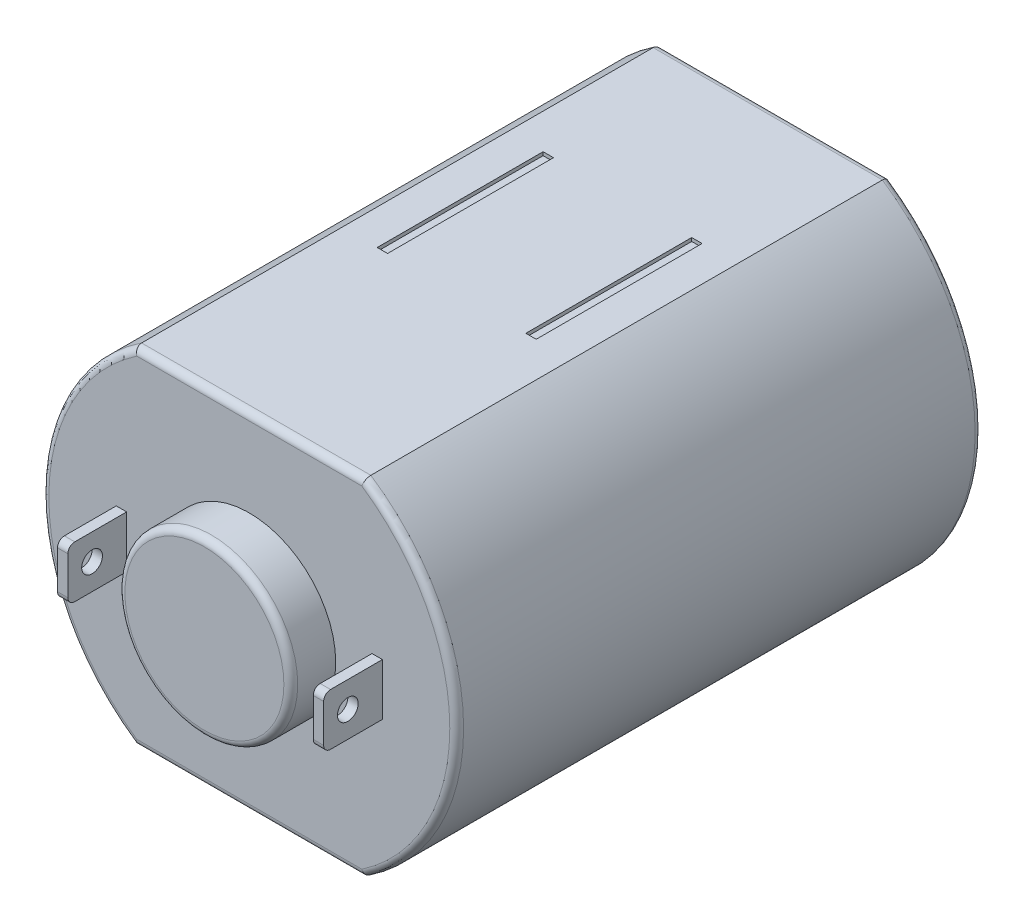
from build123d import *

# Parameters (mm, degrees)
AUFSATZ_LINEAR_AUSTRAGEN1_DEPTH = 15.2
SKIZZE2_R                       = 2.5
AUFSATZ_LINEAR_AUSTRAGEN2_DEPTH = 1.3
SKIZZE3_R                       = 0.5
AUFSATZ_LINEAR_AUSTRAGEN3_DEPTH = 2
VERRUNDUNG1_R                   = 0.2
SKIZZE4_W                       = 0.3
SKIZZE4_H                       = 4.8
SCHNITT_LINEAR_AUSTRAGEN1_DEPTH = 0.1
SKIZZE5_W                       = 0.3
SKIZZE5_H                       = 1.5
AUFSATZ_LINEAR_AUSTRAGEN4_DEPTH = 1.7
SCHNITT_LINEAR_AUSTRAGEN2_REACH = 22.19
SKIZZE6_R                       = 0.3
VERRUNDUNG2_R                   = 0.2


with BuildPart() as part:
    # Skizze1 → Aufsatz-Linear austragen1 (new body)
    with BuildSketch(Plane.XY):
        with BuildLine():
            Line((-3.31662479, 5), (3.31662479, 5))
            ThreePointArc((3.31662479, 5), (6, 0), (3.31662479, -5))
            Line((3.31662479, -5), (-3.31662479, -5))
            ThreePointArc((-3.31662479, -5), (-6, 0), (-3.31662479, 5))
        make_face()
    extrude(amount=AUFSATZ_LINEAR_AUSTRAGEN1_DEPTH)

    # Skizze2 → Aufsatz-Linear austragen2 (add)
    with BuildSketch(Plane.XY.offset(15.2)):
        Circle(SKIZZE2_R)
    extrude(amount=AUFSATZ_LINEAR_AUSTRAGEN2_DEPTH)

    # Skizze3 → Aufsatz-Linear austragen3 (add)
    with BuildSketch(Plane(origin=(0, 0, 0), x_dir=(-1, 0, 0), z_dir=(0, 0, -1))):
        with Locations(Location((0, 0, 0), (0, 0, 180))):
            Circle(SKIZZE3_R)
    extrude(amount=AUFSATZ_LINEAR_AUSTRAGEN3_DEPTH)

    # Verrundung1
    verrundung1_edges = [part.edges().sort_by_distance(p)[0] for p in [
        (6, 0, 15.2),
        (0, 5, 15.2),
        (-2.5, 0, 16.5),
        (-6, 0, 15.2),
        (0, 5, 0),
        (6, 0, 0),
        (0, -5, 0),
        (-6, 0, 0),
        (0, -5, 15.2),
    ]]
    fillet(verrundung1_edges, radius=VERRUNDUNG1_R)

    # Skizze4 → Schnitt-Linear austragen1 (cut)
    with BuildSketch(Plane(origin=(0, 5, 0), x_dir=(1, 0, 0), z_dir=(0, 1, 0))):
        with Locations((-2.15, -6.8)):
            Rectangle(SKIZZE4_W, SKIZZE4_H)
        with Locations((2.15, -6.8)):
            Rectangle(SKIZZE4_W, SKIZZE4_H)
    schnitt_linear_austragen1 = extrude(amount=-SCHNITT_LINEAR_AUSTRAGEN1_DEPTH, mode=Mode.SUBTRACT)

    # Spiegeln1: Schnitt-Linear austragen1 across plane
    add(schnitt_linear_austragen1.mirror(Plane.ZX), mode=Mode.SUBTRACT)

    # Skizze5 → Aufsatz-Linear austragen4 (add)
    with BuildSketch(Plane.XY.offset(15.2)):
        with Locations((-3.7, 0)):
            Rectangle(SKIZZE5_W, SKIZZE5_H)
        with Locations((3.7, 0)):
            Rectangle(SKIZZE5_W, SKIZZE5_H)
    extrude(amount=AUFSATZ_LINEAR_AUSTRAGEN4_DEPTH)

    # Skizze6 → Schnitt-Linear austragen2 (cut, up to next)
    with BuildSketch(Plane.ZY.offset(3.85), mode=Mode.PRIVATE) as schnitt_linear_austragen2_sk1:
        with Locations((16.2, 0)):
            Circle(SKIZZE6_R)
    schnitt_linear_austragen2_tool1 = extrude(schnitt_linear_austragen2_sk1.sketch, amount=-SCHNITT_LINEAR_AUSTRAGEN2_REACH, mode=Mode.PRIVATE) & part.part
    schnitt_linear_austragen2 = schnitt_linear_austragen2_tool1.solids().sort_by_distance((-3.85, 0, 16.2))[0]
    add(schnitt_linear_austragen2, mode=Mode.SUBTRACT)

    # Spiegeln6: Schnitt-Linear austragen2 across plane
    add(schnitt_linear_austragen2.mirror(Plane(origin=(0, 0, 0), x_dir=(0, 0, 1), z_dir=(1, 0, 0))), mode=Mode.SUBTRACT)

    # Verrundung2
    verrundung2_edges = [part.edges().sort_by_distance(p)[0] for p in [
        (-3.7, -0.75, 16.9),
        (-3.7, 0.75, 16.9),
        (3.7, -0.75, 16.9),
        (3.7, 0.75, 16.9),
    ]]
    fillet(verrundung2_edges, radius=VERRUNDUNG2_R)


solid = part.part
